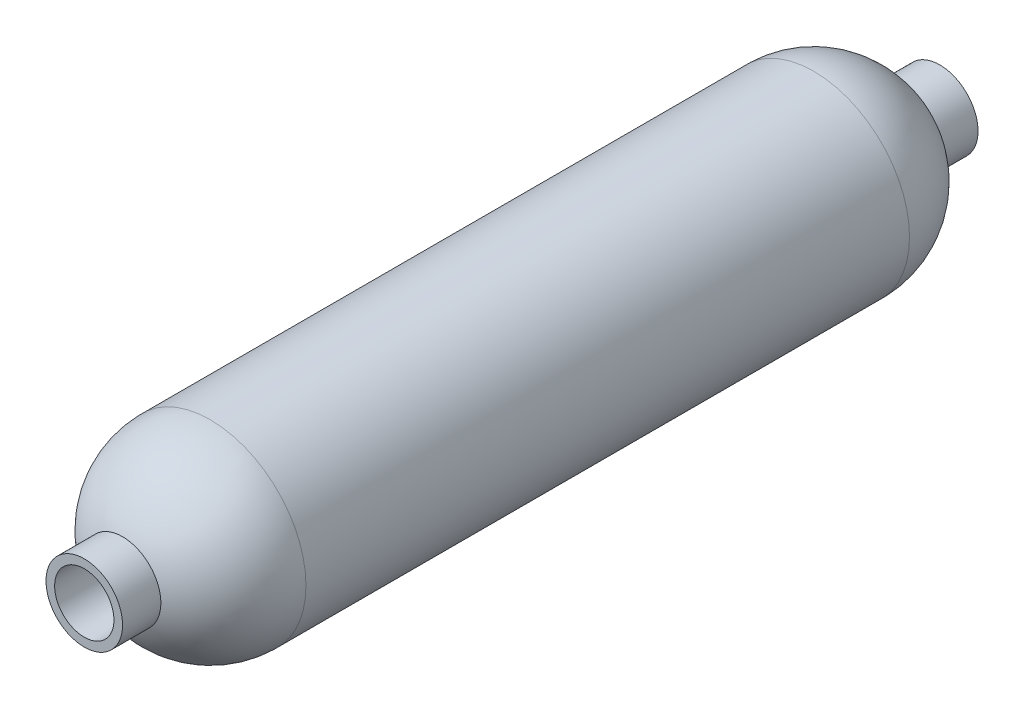
from build123d import *

# Parameters (mm, degrees)
SHELL1_T = -2.286


with BuildPart() as part:
    # Sketch1 → Revolve1 (revolve)
    with BuildSketch(Plane(origin=(0, 0, 0), x_dir=(0, 0, -1), z_dir=(1, 0, 0)), mode=Mode.PRIVATE) as revolve1_sk:
        with BuildLine():
            Line((113.538, 0), (-113.538, 0))
            Line((-113.538, 0), (-113.538, 10.16))
            Line((-113.538, 10.16), (-103.378, 10.16))
            ThreePointArc((-103.378, 10.16), (-94.01066843, 21.251164674), (-80.09851547, 25.4))
            Line((-80.09851547, 25.4), (80.09851547, 25.4))
            ThreePointArc((80.09851547, 25.4), (94.01066843, 21.251164674), (103.378, 10.16))
            Line((103.378, 10.16), (113.538, 10.16))
            Line((113.538, 10.16), (113.538, 0))
        make_face()
    revolve(revolve1_sk.sketch.rotate(Axis((0, 0, -113.538), (0, 0, 1)), 90), axis=Axis((0, 0, -113.538), (0, 0, 1)))

    # Shell1
    shell1_openings = [part.faces().sort_by_distance(p)[0] for p in [
        (0, 0, 113.538),
        (0, 0, -113.538),
    ]]
    offset(amount=SHELL1_T, openings=shell1_openings, kind=Kind.INTERSECTION)


solid = part.part
